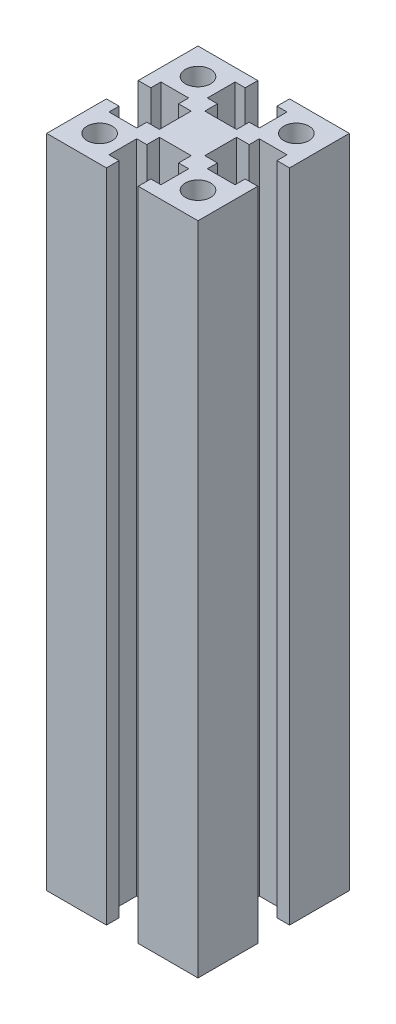
from build123d import *

# Parameters (mm, degrees)
SKETCH_1_R          = 2.5
EXTRUDE_1_DEPTH     = 180
SKETCH_2_R          = 82.250528809
CUT_EXTRUDE_1_DEPTH = 10
SKETCH_3_R          = 47.359827943
CUT_EXTRUDE_2_DEPTH = 200
SKETCH_4_R          = 50.055938799
CUT_EXTRUDE_3_DEPTH = 30
SKETCH_5_R          = 35.776746529
CUT_EXTRUDE_4_DEPTH = 40
SKETCH_1_3_R        = 2.5
EXTRUDE_2_DEPTH     = 200
SKETCH_6_R          = 45.508426161
CUT_EXTRUDE_5_DEPTH = 50
SKETCH_7_R          = 85.251485325
CUT_EXTRUDE_7_DEPTH = 20


with BuildPart() as part:
    # 草图1 → 凸台-拉伸1 (new, symmetric)
    with BuildSketch(Plane(origin=(0, 0, 0), x_dir=(1, 0, 0), z_dir=(0, 1, 0))):
        Polygon((-15, -3.15), (-12.5, -3.15), (-12.5, -5.15), (-7, -5.15), (-7, -3.15), (-4.5, -3.15), (-4.5, 3.15), (-7, 3.15), (-7, 5.15), (-12.5, 5.15), (-12.5, 3.15), (-15, 3.15), (-15, 15), (-3.15, 15), (-3.15, 12.5), (-5.15, 12.5), (-5.15, 7), (-3.15, 7), (-3.15, 4.5), (3.15, 4.5), (3.15, 7), (5.15, 7), (5.15, 12.5), (3.15, 12.5), (3.15, 15), (15, 15), (15, 3.15), (12.5, 3.15), (12.5, 5.15), (7, 5.15), (7, 3.15), (4.5, 3.15), (4.5, -3.15), (7, -3.15), (7, -5.15), (12.5, -5.15), (12.5, -3.15), (15, -3.15), (15, -15), (3.15, -15), (3.15, -12.5), (5.15, -12.5), (5.15, -7), (3.15, -7), (3.15, -4.5), (-3.15, -4.5), (-3.15, -7), (-5.15, -7), (-5.15, -12.5), (-3.15, -12.5), (-3.15, -15), (-15, -15), align=None)
        with Locations((-9.75, -9.75)):
            Circle(SKETCH_1_R, mode=Mode.SUBTRACT)
        with Locations((-9.75, 9.75)):
            Circle(SKETCH_1_R, mode=Mode.SUBTRACT)
        with Locations((9.75, 9.75)):
            Circle(SKETCH_1_R, mode=Mode.SUBTRACT)
        with Locations((9.75, -9.75)):
            Circle(SKETCH_1_R, mode=Mode.SUBTRACT)
    extrude(amount=EXTRUDE_1_DEPTH, both=True)

    # 草图2 → 切除-拉伸1 (cut)
    with BuildSketch(Plane(origin=(0, 180, 0), x_dir=(1, 0, 0), z_dir=(0, 1, 0))):
        Circle(SKETCH_2_R)
    extrude(amount=-CUT_EXTRUDE_1_DEPTH, mode=Mode.SUBTRACT)

    # 草图3 → 切除-拉伸2 (cut)
    with BuildSketch(Plane.XZ.offset(180)):
        with Locations((0.216432031, -1.772037256)):
            Circle(SKETCH_3_R)
    extrude(amount=-CUT_EXTRUDE_2_DEPTH, mode=Mode.SUBTRACT)

    # 草图4 → 切除-拉伸3 (cut)
    with BuildSketch(Plane.XZ.offset(-20)):
        with Locations((-1.287426062, -1.543634952)):
            Circle(SKETCH_4_R)
    extrude(amount=-CUT_EXTRUDE_3_DEPTH, mode=Mode.SUBTRACT)

    # 草图5 → 切除-拉伸4 (cut)
    with BuildSketch(Plane.XZ.offset(-50)):
        with Locations((-0.979370242, 0.864150214)):
            Circle(SKETCH_5_R)
    extrude(amount=-CUT_EXTRUDE_4_DEPTH, mode=Mode.SUBTRACT)

    # 草图1<3> → 凸台-拉伸2 (add)
    with BuildSketch(Plane(origin=(0, 0, 0), x_dir=(1, 0, 0), z_dir=(0, 1, 0))):
        Polygon((-15, -3.15), (-12.5, -3.15), (-12.5, -5.15), (-7, -5.15), (-7, -3.15), (-4.5, -3.15), (-4.5, 3.15), (-7, 3.15), (-7, 5.15), (-12.5, 5.15), (-12.5, 3.15), (-15, 3.15), (-15, 15), (-3.15, 15), (-3.15, 12.5), (-5.15, 12.5), (-5.15, 7), (-3.15, 7), (-3.15, 4.5), (3.15, 4.5), (3.15, 7), (5.15, 7), (5.15, 12.5), (3.15, 12.5), (3.15, 15), (15, 15), (15, 3.15), (12.5, 3.15), (12.5, 5.15), (7, 5.15), (7, 3.15), (4.5, 3.15), (4.5, -3.15), (7, -3.15), (7, -5.15), (12.5, -5.15), (12.5, -3.15), (15, -3.15), (15, -15), (3.15, -15), (3.15, -12.5), (5.15, -12.5), (5.15, -7), (3.15, -7), (3.15, -4.5), (-3.15, -4.5), (-3.15, -7), (-5.15, -7), (-5.15, -12.5), (-3.15, -12.5), (-3.15, -15), (-15, -15), align=None)
        with Locations((-9.75, -9.75)):
            Circle(SKETCH_1_3_R, mode=Mode.SUBTRACT)
        with Locations((-9.75, 9.75)):
            Circle(SKETCH_1_3_R, mode=Mode.SUBTRACT)
        with Locations((9.75, 9.75)):
            Circle(SKETCH_1_3_R, mode=Mode.SUBTRACT)
        with Locations((9.75, -9.75)):
            Circle(SKETCH_1_3_R, mode=Mode.SUBTRACT)
    extrude(amount=EXTRUDE_2_DEPTH)

    # 草图6 → 切除-拉伸5 (cut)
    with BuildSketch(Plane(origin=(0, 200, 0), x_dir=(1, 0, 0), z_dir=(0, 1, 0))):
        with Locations((-0.666782572, 0.500086929)):
            Circle(SKETCH_6_R)
    extrude(amount=-CUT_EXTRUDE_5_DEPTH, mode=Mode.SUBTRACT)

    # 草图7 → 切除-拉伸7 (cut)
    with BuildSketch(Plane(origin=(0, 150, 0), x_dir=(1, 0, 0), z_dir=(0, 1, 0))):
        with Locations((0, -1.241240206)):
            Circle(SKETCH_7_R)
    extrude(amount=-CUT_EXTRUDE_7_DEPTH, mode=Mode.SUBTRACT)


solid = part.part
